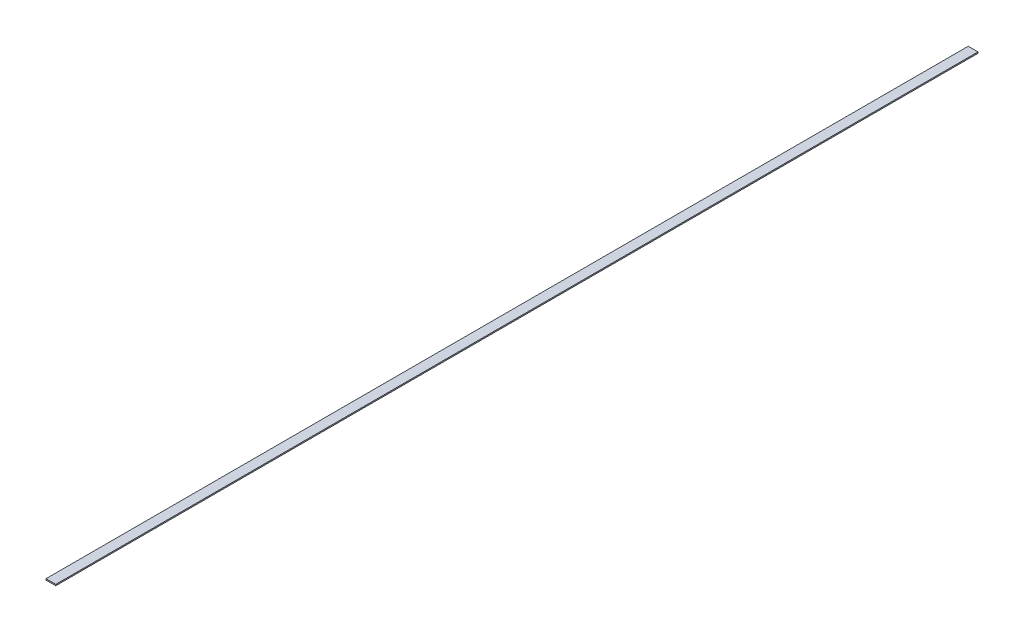
from build123d import *

# Parameters (mm, degrees)
SKETCH1_W      = 15.875
SKETCH1_H      = 1498.6
EXTRUDE1_DEPTH = 2.032


with BuildPart() as part:
    # Sketch1 → Extrude1 (new body)
    with BuildSketch(Plane(origin=(0, 0, 0), x_dir=(1, 0, 0), z_dir=(0, 1, 0))):
        with Locations((0, 749.3)):
            Rectangle(SKETCH1_W, SKETCH1_H)
    extrude(amount=EXTRUDE1_DEPTH)


solid = part.part
